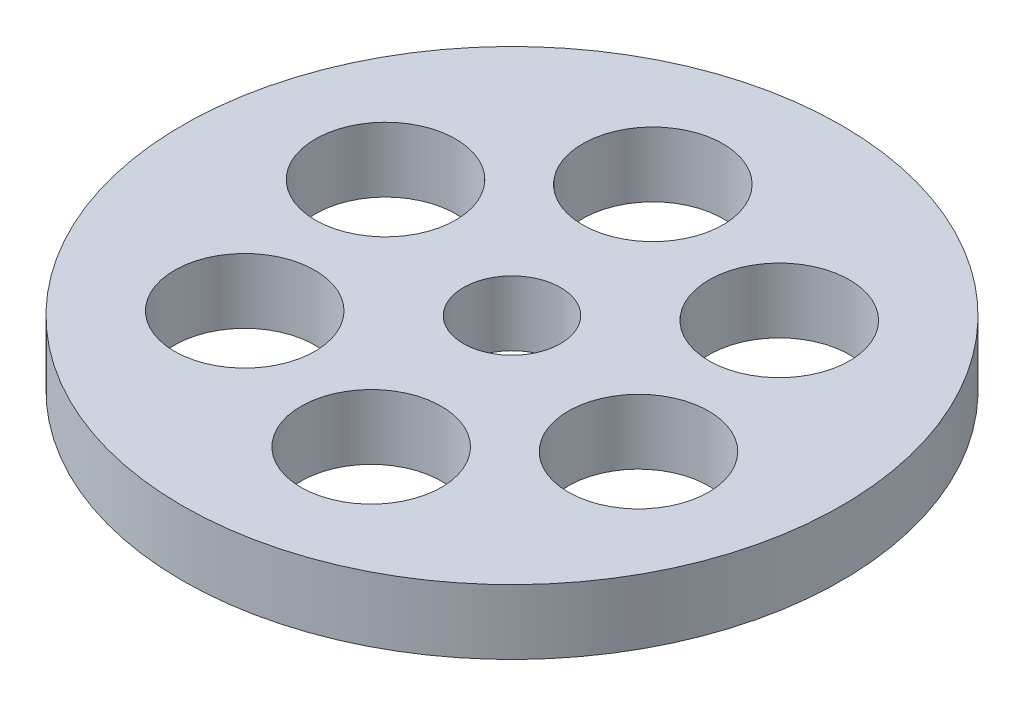
from build123d import *

# Parameters (mm, degrees)
SZKIC2_R                    = 30.5
DODANIE_WYCI_GNI_CIE2_DEPTH = 6
OTW_R_9_0_9_1_D             = 9
SZKIC8_R                    = 6.5
WYTNIJ_WYCI_GNI_CIE2_DEPTH  = 6


with BuildPart() as part:
    # Szkic2 → Dodanie-wyciągnięcie2 (new body)
    with BuildSketch(Plane(origin=(0, 0, 0), x_dir=(1, 0, 0), z_dir=(0, 1, 0))):
        with Locations(Location((0, 0, 0), (0, 0, 270))):
            Circle(SZKIC2_R)
    extrude(amount=DODANIE_WYCI_GNI_CIE2_DEPTH)

    # Otwór Ø9.0 (9)1 (through all)
    with Locations(Plane(origin=(0, 6, 0), x_dir=(1, 0, 0), z_dir=(0, 1, 0))):
        with Locations((0, 0)):
            Hole(OTW_R_9_0_9_1_D / 2)

    # Szkic8 → Wytnij-wyciągnięcie2 (cut)
    with BuildSketch(Plane(origin=(0, 6, 0), x_dir=(1, 0, 0), z_dir=(0, 1, 0))):
        with Locations(Location((-12.751231108, -11.985662487, 0), (0, 0, 270))):
            Circle(SZKIC8_R)
        with Locations(Location((-16.755503748, 5.050058825, 0), (0, 0, 270))):
            Circle(SZKIC8_R)
        with Locations(Location((-4.004272641, 17.035721312, 0), (0, 0, 270))):
            Circle(SZKIC8_R)
        with Locations(Location((12.751231108, 11.985662487, 0), (0, 0, 270))):
            Circle(SZKIC8_R)
        with Locations(Location((16.755503748, -5.050058825, 0), (0, 0, 270))):
            Circle(SZKIC8_R)
        with Locations(Location((4.004272641, -17.035721312, 0), (0, 0, 270))):
            Circle(SZKIC8_R)
    extrude(amount=-WYTNIJ_WYCI_GNI_CIE2_DEPTH, mode=Mode.SUBTRACT)


solid = part.part
